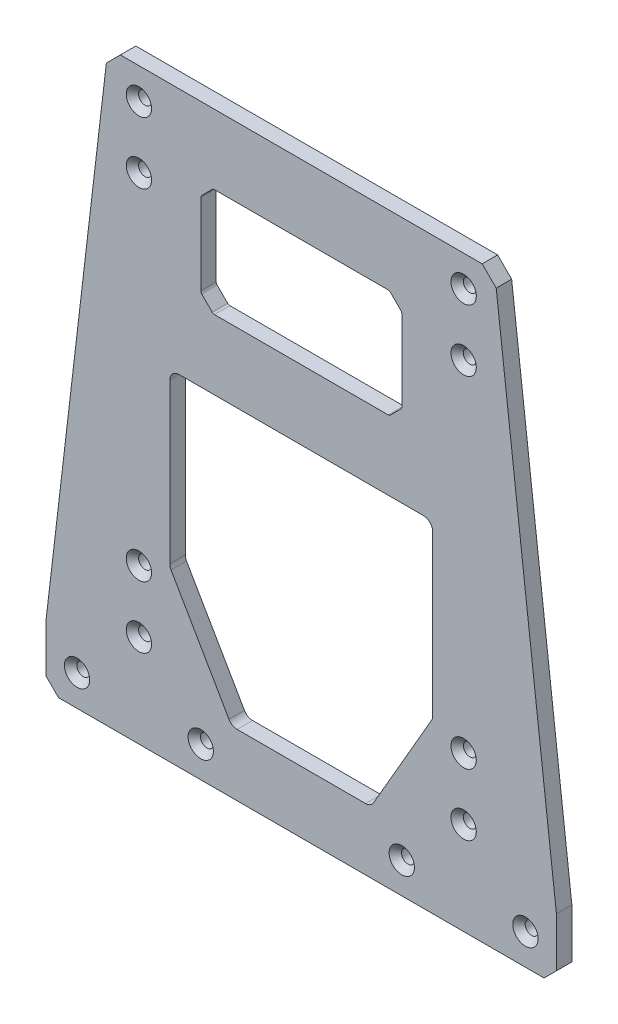
from build123d import *
from OCP.BRepFilletAPI import BRepFilletAPI_MakeChamfer

# Parameters (mm, degrees)
SKETCH_1_W          = 85
SKETCH_1_H          = 90
EXTRUDE_1_DEPTH     = 2.5
CHAMFER_1_SIZE      = 20
CHAMFER_1_SIZE2     = 34.641016151
SKETCH_2_R          = 2.1
CUT_EXTRUDE_1_DEPTH = 172.263685585
FILLET_1_R          = 3
CHAMFER_2_SIZE      = 4
CHAMFER_2_SIZE2     = 4.564598072
CHAMFER_3_SIZE      = 2
CUT_EXTRUDE_3_DEPTH = 172.263685585
CHAMFER_4_SIZE      = 4
FILLET_3_R          = 1


with BuildPart() as part:
    # 草图1 → 凸台-拉伸1 (new, symmetric)
    with BuildSketch(Plane.XY):
        Polygon((-82.5, -150), (82.5, -150), (82.5, -130), (62.5, 40), (-62.5, 40), (-82.5, -130), align=None)
        with Locations((0, -85)):
            Rectangle(SKETCH_1_W, SKETCH_1_H, mode=Mode.SUBTRACT)
    extrude(amount=EXTRUDE_1_DEPTH, both=True)

    # 倒角1
    chamfer_1_edges = [part.edges().sort_by_distance(p)[0] for p in [
        (-42.5, -130, 0),
        (42.5, -130, 0),
    ]]
    chamfer_1_side = [part.faces().sort_by_distance(p)[0] for p in [
        (0, -130, 0),
    ]]
    chamfer(chamfer_1_edges, length=CHAMFER_1_SIZE, length2=CHAMFER_1_SIZE2, reference=chamfer_1_side[0])

    # 草图2 → 切除-拉伸1 (cut, through all)
    with BuildSketch(Plane.XY.offset(2.5)):
        with Locations((-72.5, -140)):
            Circle(SKETCH_2_R)
        with Locations((-32.5, -140)):
            Circle(SKETCH_2_R)
        with Locations((-52.5, 30)):
            Circle(SKETCH_2_R)
        with Locations((-52.5, 10)):
            Circle(SKETCH_2_R)
        with Locations((-52.5, -100)):
            Circle(SKETCH_2_R)
        with Locations((-52.5, -120)):
            Circle(SKETCH_2_R)
        with Locations(Location((52.5, 30, 0), (0, 0, 180))):
            Circle(SKETCH_2_R)
        with Locations(Location((52.5, 10, 0), (0, 0, 180))):
            Circle(SKETCH_2_R)
        with Locations(Location((52.5, -100, 0), (0, 0, 180))):
            Circle(SKETCH_2_R)
        with Locations(Location((52.5, -120, 0), (0, 0, 180))):
            Circle(SKETCH_2_R)
        with Locations(Location((32.5, -140, 0), (0, 0, 180))):
            Circle(SKETCH_2_R)
        with Locations(Location((72.5, -140, 0), (0, 0, 180))):
            Circle(SKETCH_2_R)
    extrude(amount=-CUT_EXTRUDE_1_DEPTH, mode=Mode.SUBTRACT)

    # 圆角1
    fillet_1_edges = [part.edges().sort_by_distance(p)[0] for p in [
        (-42.5, -40, 0),
        (42.5, -40, 0),
        (-22.5, -130, 0),
        (22.5, -130, 0),
        (42.5, -95.358983849, 0),
        (-42.5, -95.358983849, 0),
    ]]
    fillet(fillet_1_edges, radius=FILLET_1_R)

    # 倒角2: one chamfer whose edges measure the first distance from different faces: ONE call of the kernel's chamfer builder (chamfer() names one face for all edges)
    chamfer_2_edges_1 = [part.edges().sort_by_distance(p)[0] for p in [
        (-62.5, 40, 0),
        (62.5, 40, 0),
    ]]
    chamfer_2_side_1 = [part.faces().sort_by_distance(p)[0] for p in [
        (0, 40, 0),
    ]]
    chamfer_2_edges_2 = [part.edges().sort_by_distance(p)[0] for p in [
        (82.5, -150, 0),
        (-82.5, -150, 0),
    ]]
    chamfer_2 = BRepFilletAPI_MakeChamfer(part.part.solid().wrapped)
    for e in chamfer_2_edges_1:
        chamfer_2.Add(CHAMFER_2_SIZE, CHAMFER_2_SIZE2, e.wrapped, chamfer_2_side_1[0].wrapped)  # the first distance lies on this face
    for e in chamfer_2_edges_2:
        chamfer_2.Add(CHAMFER_2_SIZE, e.wrapped)
    add(Compound.cast(chamfer_2.Shape()), mode=Mode.REPLACE)

    # 倒角3
    chamfer_3_edges = [part.edges().sort_by_distance(p)[0] for p in [
        (-74.6, -140, 2.5),
        (74.6, -140, 2.5),
        (34.6, -140, 2.5),
        (54.6, -120, 2.5),
        (-54.6, -100, 2.5),
        (-54.6, 10, 2.5),
        (-54.6, 30, 2.5),
        (-34.6, -140, 2.5),
        (54.6, -100, 2.5),
        (54.6, 10, 2.5),
        (54.6, 30, 2.5),
        (-54.6, -120, 2.5),
    ]]
    chamfer(chamfer_3_edges, length=CHAMFER_3_SIZE)

    # 草图4 → 切除-拉伸3 (cut, through all)
    with BuildSketch(Plane(origin=(0, 0, -2.5), x_dir=(-1, 0, 0), z_dir=(0, 0, -1))):
        Polygon((0, -17.5), (-32.5, -17.5), (-32.5, 17.5), (0, 17.5), (32.5, 17.5), (32.5, -17.5), align=None)
    extrude(amount=-CUT_EXTRUDE_3_DEPTH, mode=Mode.SUBTRACT)

    # 倒角4
    chamfer_4_edges = [part.edges().sort_by_distance(p)[0] for p in [
        (32.5, -17.5, 0),
        (32.5, 17.5, 0),
        (-32.5, 17.5, 0),
        (-32.5, -17.5, 0),
    ]]
    chamfer(chamfer_4_edges, length=CHAMFER_4_SIZE)

    # 圆角3
    fillet_3_edges = [part.edges().sort_by_distance(p)[0] for p in [
        (-32.5, 13.5, 0),
        (-32.5, -13.5, 0),
        (28.5, -17.5, 0),
        (-28.5, -17.5, 0),
        (28.5, 17.5, 0),
        (-28.5, 17.5, 0),
        (32.5, 13.5, 0),
        (32.5, -13.5, 0),
    ]]
    fillet(fillet_3_edges, radius=FILLET_3_R)


solid = part.part
